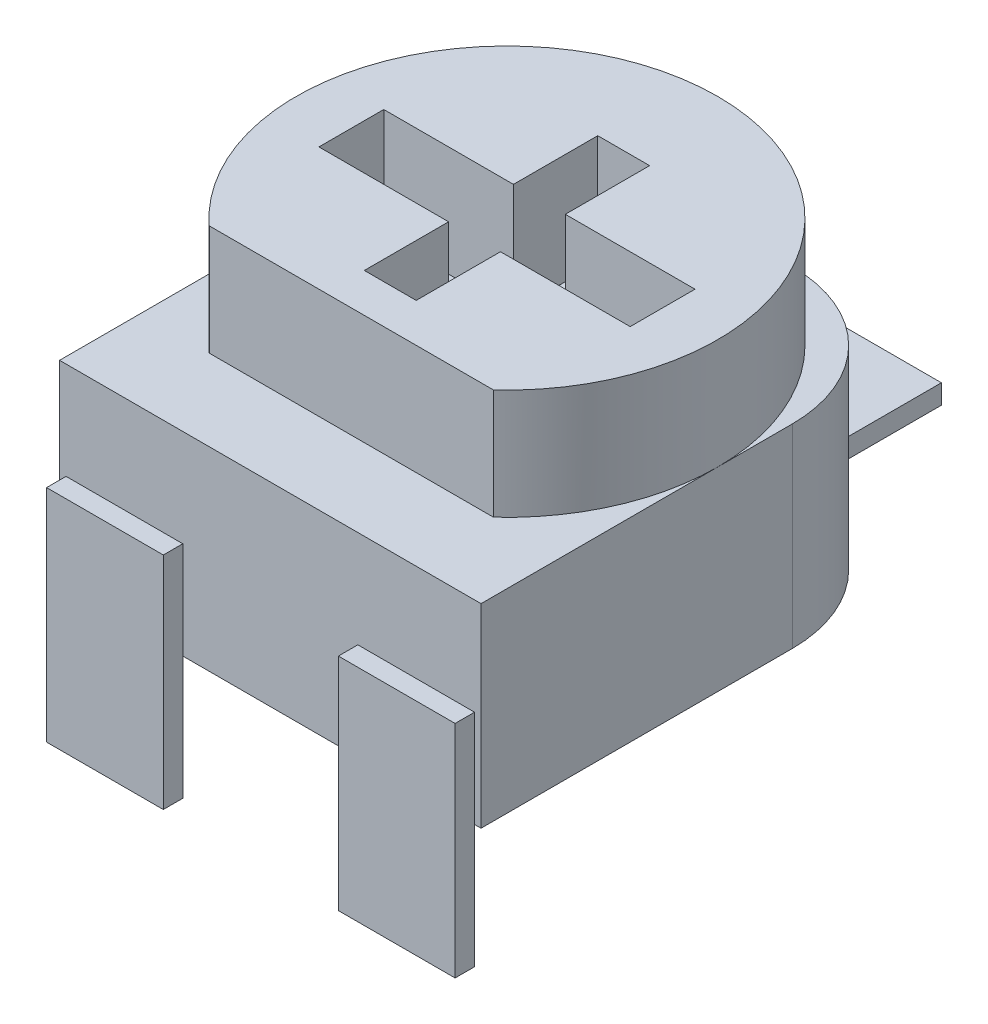
from build123d import *

# Parameters (mm, degrees)
SKETCH_1_W          = 6.5
SKETCH_1_H          = 6.9
EXTRUDE_1_DEPTH     = 3
EXTRUDE_START       = 3
SKETCH_1_3_R        = 3.25
EXTRUDE_2_DEPTH     = 1.7
CUT_EXTRUDE_START   = 3
CUT_EXTRUDE_1_DEPTH = 1.7
FILLET_1_R          = 2.1
SKETCH_2_W          = 1.8
SKETCH_2_H          = 3.4
EXTRUDE_3_DEPTH     = 0.3
SKETCH_3_W          = 2.3
SKETCH_3_H          = 0.3
EXTRUDE_4_DEPTH     = 2.3


with BuildPart() as part:
    # 草图1 → 凸台-拉伸1 (new body)
    with BuildSketch(Plane(origin=(0, 0, 0), x_dir=(1, 0, 0), z_dir=(0, 1, 0))):
        with Locations((0, -0.2)):
            Rectangle(SKETCH_1_W, SKETCH_1_H)
    extrude(amount=EXTRUDE_1_DEPTH)

    # 草图1<3> → 凸台-拉伸2 (add)
    with BuildSketch(Plane(origin=(0, 0, 0), x_dir=(1, 0, 0), z_dir=(0, 1, 0)).offset(EXTRUDE_START)):
        with Locations(Location((0, 0, 0), (0, 0, 90))):
            Circle(SKETCH_1_3_R)
        Polygon((-2.4, -0.5), (-2.4, 0.5), (-0.4, 0.5), (-0.4, 1.8), (0.4, 1.8), (0.4, 0.5), (2.4, 0.5), (2.4, -0.5), (0.4, -0.5), (0.4, -1.8), (-0.4, -1.8), (-0.4, -0.5), align=None, mode=Mode.SUBTRACT)
    extrude(amount=EXTRUDE_2_DEPTH)

    # 草图1<4> → 切除-拉伸1 (cut)
    with BuildSketch(Plane(origin=(0, 0, 0), x_dir=(1, 0, 0), z_dir=(0, 1, 0)).offset(CUT_EXTRUDE_START)):
        with BuildLine():
            Line((2.1914607, -2.4), (-2.1914607, -2.4))
            ThreePointArc((-2.1914607, -2.4), (0, -3.25), (2.1914607, -2.4))
        make_face()
    extrude(amount=CUT_EXTRUDE_1_DEPTH, mode=Mode.SUBTRACT)

    # 圆角1
    fillet_1_edges = [part.edges().sort_by_distance(p)[0] for p in [
        (-3.25, 1.5, -3.25),
        (3.25, 1.5, -3.25),
    ]]
    fillet(fillet_1_edges, radius=FILLET_1_R)

    # 草图2 → 凸台-拉伸3 (add)
    with BuildSketch(Plane.XY.offset(3.65)):
        with Locations((-2.25, -0.2)):
            Rectangle(SKETCH_2_W, SKETCH_2_H)
        with Locations((2.25, -0.2)):
            Rectangle(SKETCH_2_W, SKETCH_2_H)
    extrude(amount=EXTRUDE_3_DEPTH)

    # 草图3 → 凸台-拉伸4 (add)
    with BuildSketch(Plane(origin=(0, 0, -3.25), x_dir=(-1, 0, 0), z_dir=(0, 0, -1))):
        with Locations((0, 0.15)):
            Rectangle(SKETCH_3_W, SKETCH_3_H)
    extrude(amount=EXTRUDE_4_DEPTH)


solid = part.part
